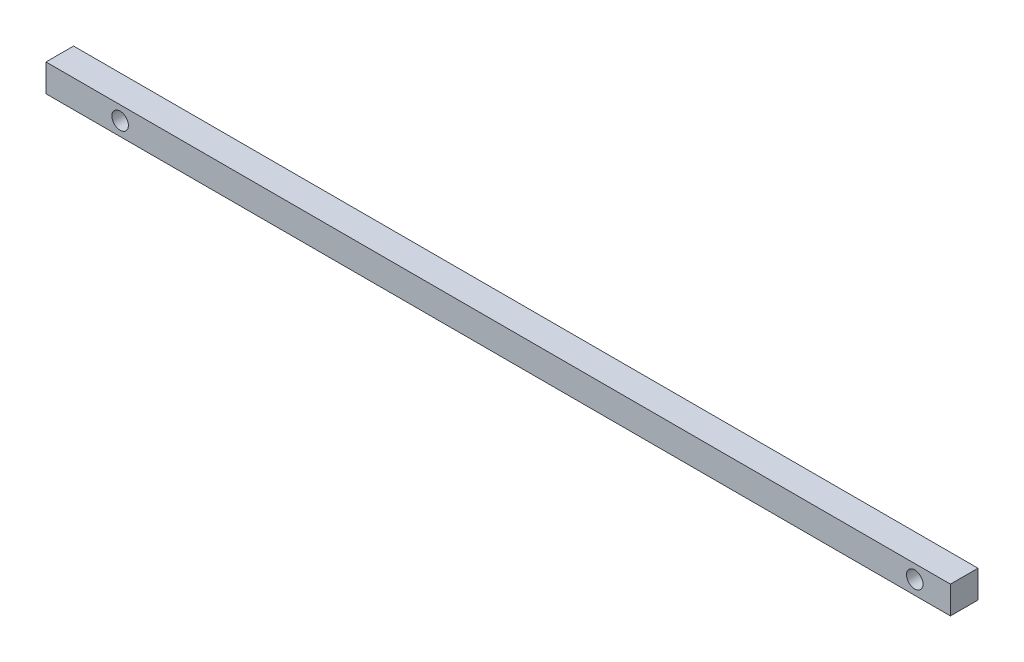
from build123d import *

# Parameters (mm, degrees)
SKETCH1_W           = 820
SKETCH1_H           = 25
SKETCH1_R           = 7.5
BOSS_EXTRUDE1_DEPTH = 25


with BuildPart() as part:
    # Sketch1 → Boss-Extrude1 (new body)
    with BuildSketch(Plane.XY):
        Rectangle(SKETCH1_W, SKETCH1_H)
        with Locations((-342.78710735, 0)):
            Circle(SKETCH1_R, mode=Mode.SUBTRACT)
        with Locations((377.64289265, 0)):
            Circle(SKETCH1_R, mode=Mode.SUBTRACT)
    extrude(amount=BOSS_EXTRUDE1_DEPTH)


solid = part.part
